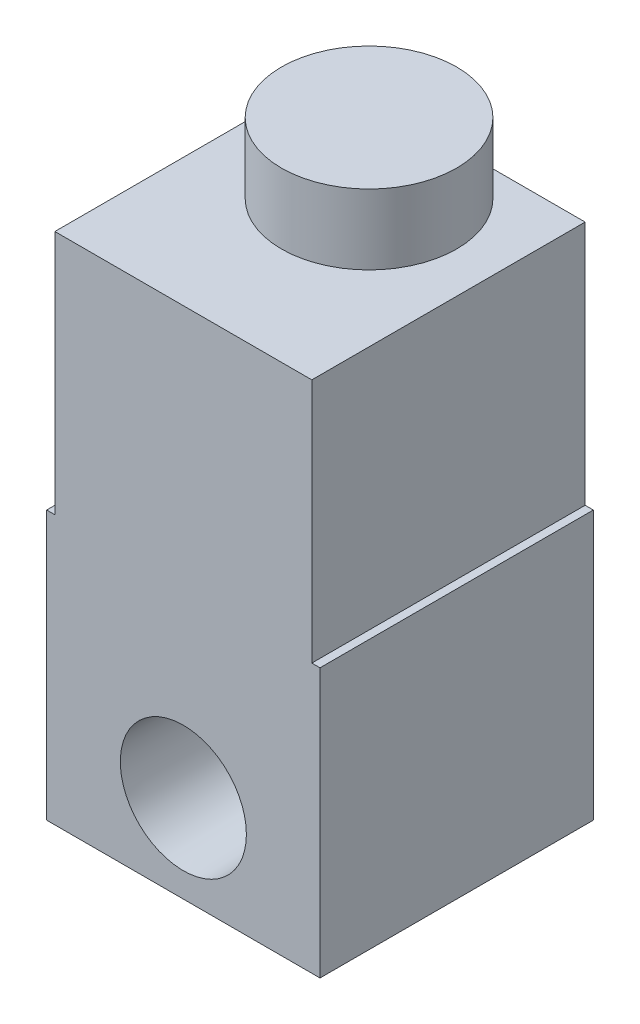
from build123d import *

# Parameters (mm, degrees)
BOSS_EXTRUDE1_DEPTH = 29.718
SKETCH3_R           = 9.525
BOSS_EXTRUDE2_DEPTH = 7.62


with BuildPart() as part:
    # Sketch1 → Boss-Extrude1 (new body)
    with BuildSketch(Plane.XY):
        Polygon((0, 0), (0, 29.21), (0.889, 29.21), (0.889, 55.88), (28.829, 55.88), (28.829, 29.21), (29.718, 29.21), (29.718, 0), align=None)
    extrude(amount=BOSS_EXTRUDE1_DEPTH)

    # Sketch3 → Boss-Extrude2 (add)
    with BuildSketch(Plane(origin=(0, 55.88, 0), x_dir=(1, 0, 0), z_dir=(0, 1, 0))):
        with Locations(Location((14.859, -9.525, 0), (0, 0, 90))):
            Circle(SKETCH3_R)
    extrude(amount=BOSS_EXTRUDE2_DEPTH)

    # Sketch13 → 1/4 NPT Tapped Hole1 (revolve, cut)
    with BuildSketch(Plane(origin=(14.859, 9.525, 29.718), x_dir=(0, -1, 0), z_dir=(1, 0, 0))):
        Polygon((0, 0), (0, 29.718), (6.1976, 29.718), (5.5626, 29.083), (5.5626, 9.906), (6.557984794, 9.906), (6.8545837, 0), align=None)
    revolve(axis=Axis((14.859, 9.525, 36.068), (0, 0, -1)), mode=Mode.SUBTRACT)


solid = part.part
